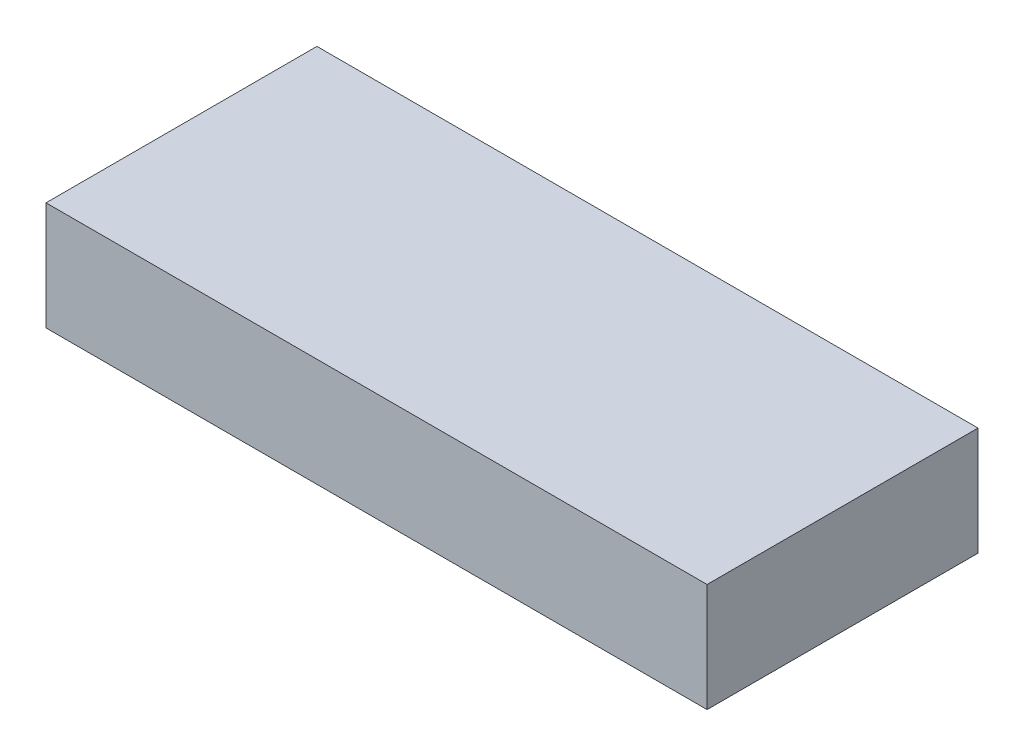
from build123d import *

# Parameters (mm, degrees)
SKETCH1_W           = 61
SKETCH1_H           = 25
BOSS_EXTRUDE1_DEPTH = 10


with BuildPart() as part:
    # Sketch1 → Boss-Extrude1 (new body)
    with BuildSketch(Plane(origin=(0, 0, 0), x_dir=(1, 0, 0), z_dir=(0, 1, 0))):
        Rectangle(SKETCH1_W, SKETCH1_H)
    extrude(amount=BOSS_EXTRUDE1_DEPTH)


solid = part.part
